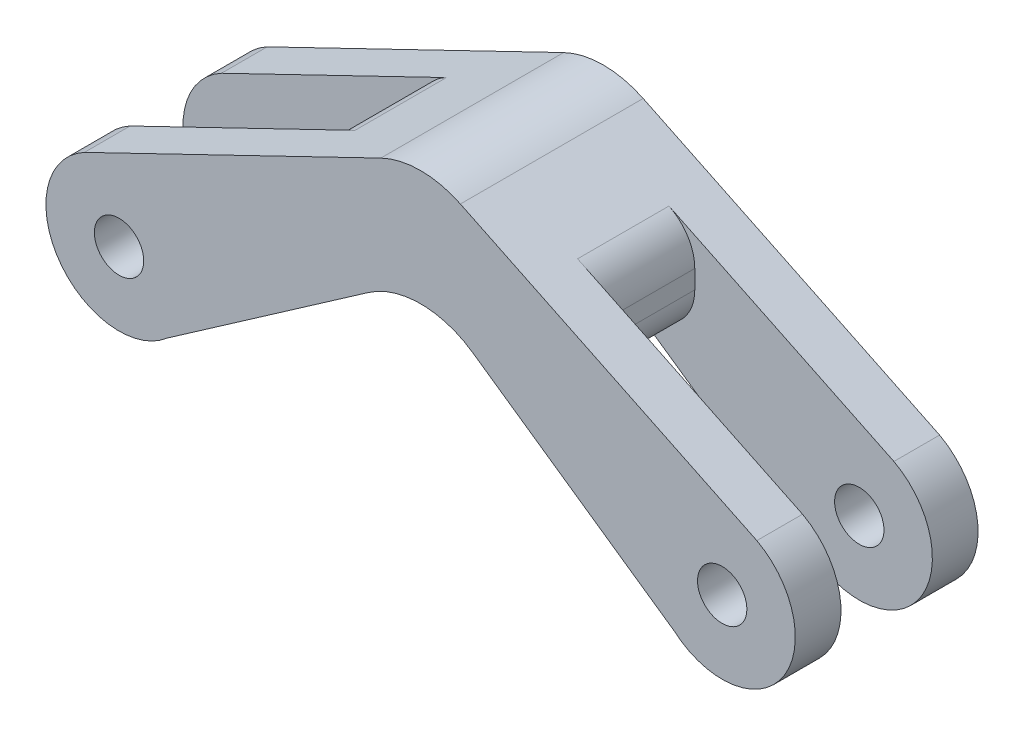
from build123d import *

# Parameters (mm, degrees)
SKETCH3_R           = 1.7145000000000004
SKETCH3_R_2         = 1.7144999999999995
BOSS_EXTRUDE1_DEPTH = 3.175
BOSS_EXTRUDE2_DEPTH = 36.83
LPATTERN2_COUNT     = 2
LPATTERN2_PITCH     = 9.525
CUT_EXTRUDE1_DEPTH  = 54.24920844482103
FILLET1_R           = 3.175


with BuildPart() as part:
    # Sketch3 → Boss-Extrude1 (new body)
    with BuildSketch(Plane.XY):
        with BuildLine():
            ThreePointArc((23.718196461855243, 14.429078391112267), (20.955, 15.061802351494215), (18.191803538144754, 14.429078391112267))
            Line((18.191803538144754, 14.429078391112265), (-2.009608404339229, 4.6656054335111925))
            Line((-2.009608404339229, 4.6656054335111925), (-2.407325349839823, 4.473386263225946))
            ThreePointArc((-2.4073253498398226, 4.473386263225944), (-4.1812606420695575, -2.885040631096911), (3.3277025000445404, -3.83833245970139))
            Line((3.3277025000445413, -3.8383324597013875), (17.32713374877397, 5.9068077182607865))
            ThreePointArc((17.32713374877397, 5.9068077182607865), (20.955, 7.045177794406333), (24.58286625122603, 5.90680771826079))
            Line((24.58286625122603, 5.906807718260788), (38.58229749995545, -3.838332459701375))
            ThreePointArc((38.58229749995546, -3.8383324597013706), (46.09126064206956, -2.8850406310969055), (44.31732534983981, 4.4733862632259465))
            Line((44.31732534983981, 4.473386263225951), (43.91960840433945, 4.665605433511086))
            Line((43.91960840433945, 4.665605433511086), (23.718196461855243, 14.429078391112267))
        make_face()
        Circle(SKETCH3_R, mode=Mode.SUBTRACT)
        with Locations((41.91, 0)):
            Circle(SKETCH3_R_2, mode=Mode.SUBTRACT)
    boss_extrude1 = extrude(amount=BOSS_EXTRUDE1_DEPTH)

    # Sketch4 → Boss-Extrude2 (add)
    with BuildSketch(Plane(origin=(0, 15.239999999999998, 0), x_dir=(1, 0, 0), z_dir=(0, 1, 0))):
        Polygon((11.43, 0), (30.480000000000004, 2.33e-15), (30.48, 6.350000000000002), (11.43, 6.35), align=None)
    extrude(amount=-BOSS_EXTRUDE2_DEPTH)

    # LPattern2: Boss-Extrude1 ×2
    with Locations(*[(0, 0, -i * LPATTERN2_PITCH) for i in range(1, LPATTERN2_COUNT)]):
        add(boss_extrude1)

    # Sketch5 → Cut-Extrude1 (cut, through all)
    with BuildSketch(Plane.XY.offset(3.175)):
        with BuildLine():
            Line((36.195, 8.398958601029964), (23.718196461855243, 14.429078391112268))
            ThreePointArc((23.718196461855243, 14.429078391112268), (20.955, 15.061802351494219), (18.191803538144754, 14.429078391112267))
            Line((18.191803538144754, 14.429078391112267), (5.715000000000005, 8.39895860102995))
            Line((5.715000000000005, 8.39895860102995), (5.714999999999998, 15.239999999999984))
            Line((5.714999999999998, 15.239999999999984), (36.195, 15.239999999999998))
            Line((36.195, 15.239999999999998), (36.195, 8.398958601029964))
        make_face()
        with BuildLine():
            Line((30.480000000000004, 1.8017555908602794), (24.58286625122603, 5.906807718260787))
            ThreePointArc((24.58286625122603, 5.906807718260787), (20.955000000000002, 7.045177794406331), (17.327133748773974, 5.906807718260784))
            Line((17.327133748773974, 5.906807718260784), (11.430000000000003, 1.8017555908602725))
            Line((11.430000000000003, 1.8017555908602725), (11.430000000000026, -23.117342691118424))
            Line((11.430000000000026, -23.117342691118424), (30.480000000000004, -23.117342691118413))
            Line((30.480000000000004, -23.117342691118413), (30.480000000000004, 1.8017555908602794))
        make_face()
    extrude(amount=-CUT_EXTRUDE1_DEPTH, mode=Mode.SUBTRACT)

    # Fillet1
    fillet1_edges = [part.edges().sort_by_distance(p)[0] for p in [
        (30.480000000000004, 1.8017555908602794, -3.1750000000000016),
        (11.430000000000003, 1.8017555908602725, -3.175),
        (30.48, 11.161055038227271, -3.1750000000000016),
        (11.43, 11.16105503822726, -3.1749999999999994),
    ]]
    fillet(fillet1_edges, radius=FILLET1_R)


solid = part.part
